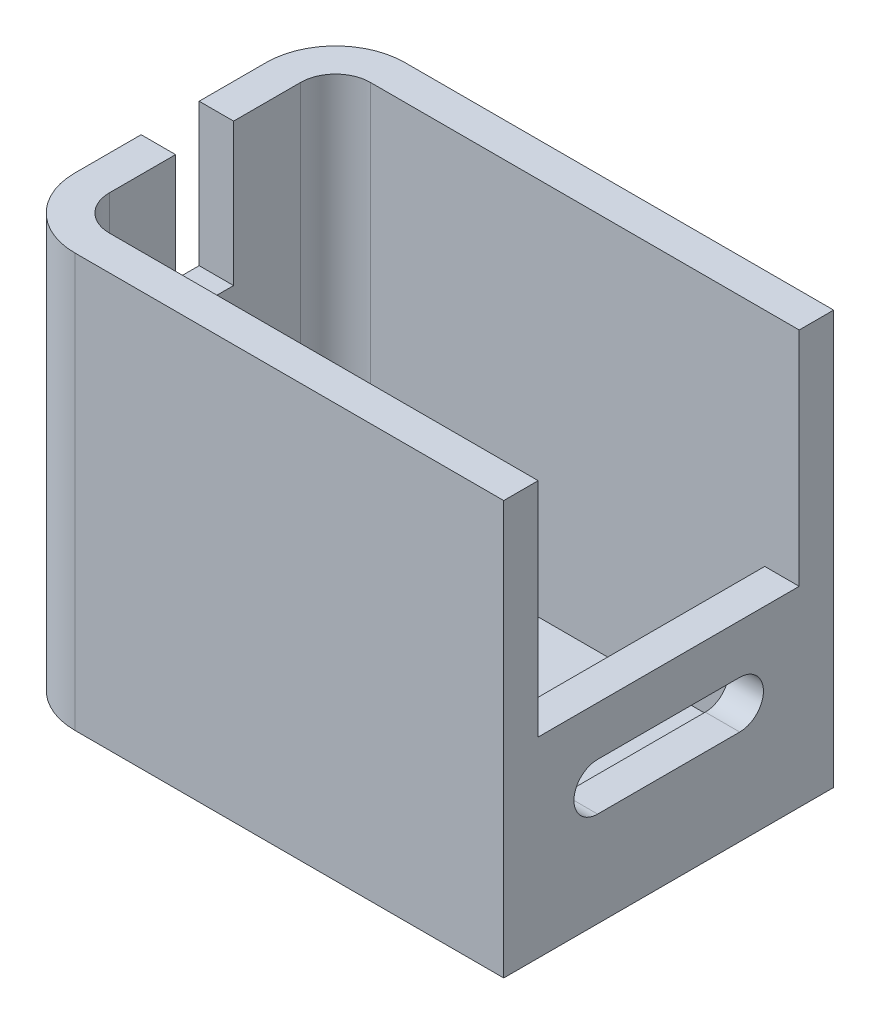
from build123d import *

# Parameters (mm, degrees)
BOSS_EXTRUDE1_DEPTH = 33
SHELL2_T            = 3
SKETCH5_W           = 22.725
SKETCH5_H           = 33
CUT_EXTRUDE1_DEPTH  = 33
CUT_EXTRUDE3_START  = 20.6
SKETCH2_4_W         = 5.050381124
SKETCH2_4_H         = 5.05
CUT_EXTRUDE3_DEPTH  = 33
BOSS_EXTRUDE2_START = -4
BOSS_EXTRUDE2_DEPTH = 4
SKETCH6_W           = 3
SKETCH6_H           = 22.725
BOSS_EXTRUDE3_DEPTH = 13.67
CUT_EXTRUDE5_DEPTH  = 13.67


with BuildPart() as part:
    # Sketch2 → Boss-Extrude1 (new body)
    with BuildSketch(Plane(origin=(0, 0, 0), x_dir=(1, 0, 0), z_dir=(0, 1, 0))):
        with BuildLine():
            Line((-16.159809438, 2.488564903), (-16.159809438, -2.561435097))
            Line((-16.159809438, -2.561435097), (-16.159809438, -8.3325))
            ThreePointArc((-16.159809438, -8.3325), (-15.272342985, -10.475033547), (-13.129809438, -11.3625))
            Line((-13.129809438, -11.3625), (21.210190562, -11.3625))
            Line((21.210190562, -11.3625), (21.210190562, 11.3625))
            Line((21.210190562, 11.3625), (-13.129809438, 11.3625))
            ThreePointArc((-13.129809438, 11.3625), (-15.272342985, 10.475033547), (-16.159809438, 8.3325))
            Line((-16.159809438, 8.3325), (-16.159809438, 2.488564903))
        make_face()
    extrude(amount=BOSS_EXTRUDE1_DEPTH)

    # Shell2
    shell2_openings = [part.faces().sort_by_distance(p)[0] for p in [
        (2.609138826, 33, 0),
    ]]
    offset(amount=SHELL2_T, openings=shell2_openings, kind=Kind.INTERSECTION)

    # Sketch5 → Cut-Extrude1 (cut)
    with BuildSketch(Plane.ZY.offset(-21.210190562)):
        with Locations((0, 16.5)):
            Rectangle(SKETCH5_W, SKETCH5_H)
    extrude(amount=-CUT_EXTRUDE1_DEPTH, mode=Mode.SUBTRACT)

    # Sketch2<4> → Cut-Extrude3 (cut)
    with BuildSketch(Plane(origin=(0, 0, 0), x_dir=(1, 0, 0), z_dir=(0, 1, 0)).offset(CUT_EXTRUDE3_START)):
        with Locations((-18.685, -0.036435097)):
            Rectangle(SKETCH2_4_W, SKETCH2_4_H)
    extrude(amount=CUT_EXTRUDE3_DEPTH, mode=Mode.SUBTRACT)

    # Sketch2<6> → Boss-Extrude2 (add)
    with BuildSketch(Plane(origin=(0, 0, 0), x_dir=(1, 0, 0), z_dir=(0, 1, 0)).offset(BOSS_EXTRUDE2_START)):
        with BuildLine():
            Line((-16.159809438, 2.488564903), (-16.159809438, -2.561435097))
            Line((-16.159809438, -2.561435097), (-16.159809438, -8.3325))
            ThreePointArc((-16.159809438, -8.3325), (-15.272342985, -10.475033547), (-13.129809438, -11.3625))
            Line((-13.129809438, -11.3625), (21.210190562, -11.3625))
            Line((21.210190562, -11.3625), (21.210190562, 11.3625))
            Line((21.210190562, 11.3625), (-13.129809438, 11.3625))
            ThreePointArc((-13.129809438, 11.3625), (-15.272342985, 10.475033547), (-16.159809438, 8.3325))
            Line((-16.159809438, 8.3325), (-16.159809438, 2.488564903))
        make_face()
    extrude(amount=BOSS_EXTRUDE2_DEPTH)

    # Sketch6 → Boss-Extrude3 (add)
    with BuildSketch(Plane(origin=(0, 0, 0), x_dir=(1, 0, 0), z_dir=(0, 1, 0))):
        with Locations((22.710190562, 0)):
            Rectangle(SKETCH6_W, SKETCH6_H)
    extrude(amount=BOSS_EXTRUDE3_DEPTH)

    # Sketch7 → Cut-Extrude5 (cut)
    with BuildSketch(Plane(origin=(24.210190562, 0, 0), x_dir=(0, 0, -1), z_dir=(1, 0, 0))):
        with BuildLine():
            Line((-6.185942712, 9.395589147), (6.185942712, 9.395589147))
            ThreePointArc((6.185942712, 9.395589147), (8.247923616, 7.333608243), (6.185942712, 5.271627338))
            Line((6.185942712, 5.271627338), (-6.185942712, 5.271627338))
            ThreePointArc((-6.185942712, 5.271627338), (-8.247923616, 7.333608243), (-6.185942712, 9.395589147))
        make_face()
    extrude(amount=-CUT_EXTRUDE5_DEPTH, mode=Mode.SUBTRACT)


solid = part.part
